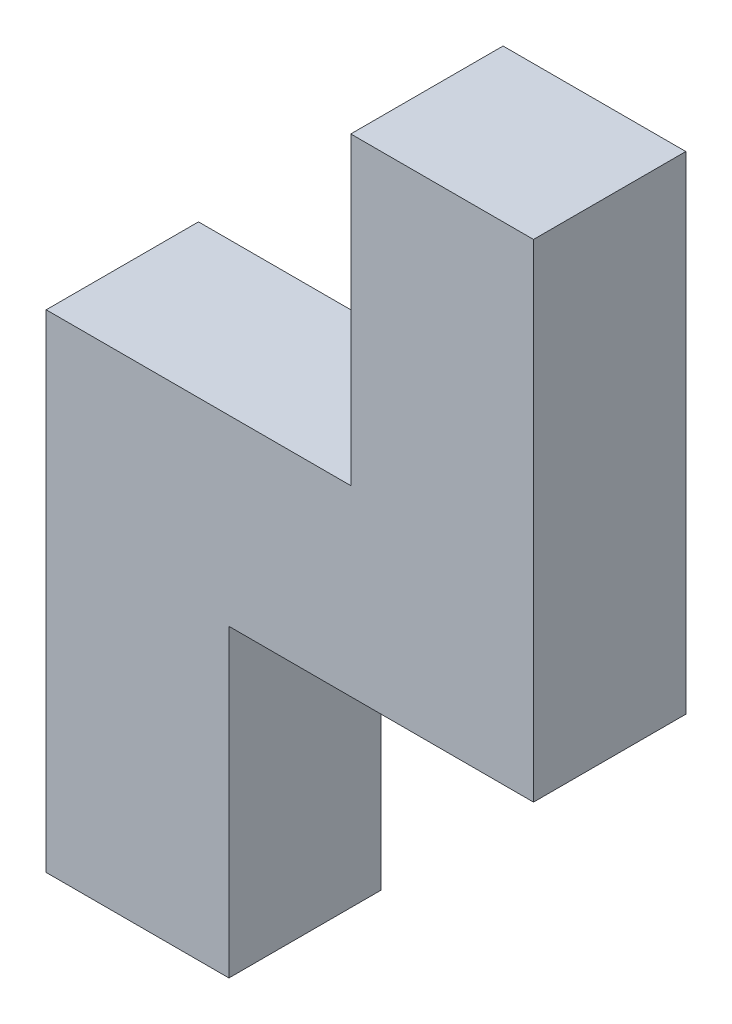
from build123d import *

# Parameters (mm, degrees)
EXTRUDE_1_DEPTH = 10


with BuildPart() as part:
    # 草圖1 → 填料-伸長1 (new body)
    with BuildSketch(Plane.XY):
        Polygon((0, 0), (12, 0), (12, 20), (32, 20), (32, 52), (20, 52), (20, 32), (0, 32), align=None)
    extrude(amount=-EXTRUDE_1_DEPTH)


solid = part.part
